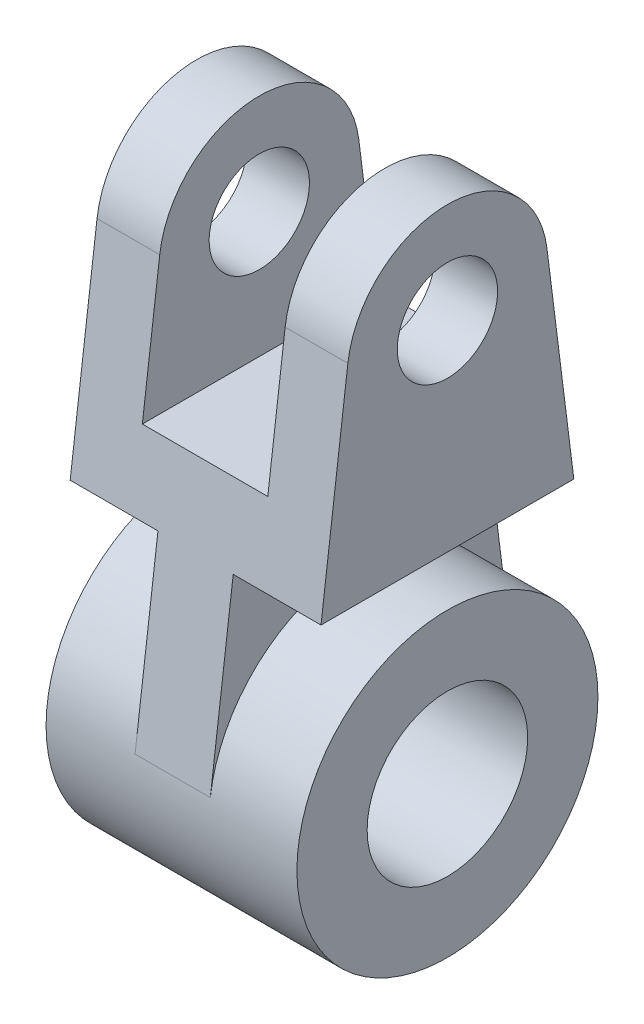
from build123d import *

# Parameters (mm, degrees)
SKETCH1_R               = 30
BOSS_EXTRUDE1_DEPTH     = 25
SKETCH2_R               = 16
CUT_EXTRUDE1_DEPTH      = 66.574385243
BOSS_EXTRUDE2_DEPTH     = 25
BOSS_EXTRUDE3_DEPTH     = 7.5
SKETCH4_R               = 10
CUT_EXTRUDE2_DEPTH      = 116.758369028
CUT_EXTRUDE3_DEPTH      = 108.354552768
CUT_EXTRUDE3_DEPTH_BACK = 108.354552768
SKETCH5_W               = 25
SKETCH5_H               = 45


with BuildPart() as part:
    # Sketch1 → Boss-Extrude1 (new, symmetric)
    with BuildSketch(Plane(origin=(0, 0, 0), x_dir=(0, 0, -1), z_dir=(1, 0, 0))):
        Circle(SKETCH1_R)
    extrude(amount=BOSS_EXTRUDE1_DEPTH, both=True)

    # Sketch2 → Cut-Extrude1 (cut, through all)
    with BuildSketch(Plane(origin=(25, 0, 0), x_dir=(0, 0, -1), z_dir=(1, 0, 0))):
        Circle(SKETCH2_R)
    extrude(amount=-CUT_EXTRUDE1_DEPTH, mode=Mode.SUBTRACT)



with BuildPart() as body_2:
    # Sketch3 → Boss-Extrude2 (new, symmetric)
    with BuildSketch(Plane(origin=(0, 0, 0), x_dir=(0, 0, -1), z_dir=(1, 0, 0))):
        with BuildLine():
            Line((-19.843134833, 82.5), (-25.197631534, 40))
            Line((-25.197631534, 40), (25.197631534, 40))
            Line((25.197631534, 40), (19.843134833, 82.5))
            ThreePointArc((19.843134833, 82.5), (0, 100), (-19.843134833, 82.5))
        make_face()
    extrude(amount=BOSS_EXTRUDE2_DEPTH, both=True)


with BuildPart() as part_1:
    add(part.part)

    add(body_2.part)  # Boss-Extrude3 merges body 2
    # Sketch3<3> → Boss-Extrude3 (add, symmetric)
    with BuildSketch(Plane(origin=(0, 0, 0), x_dir=(0, 0, -1), z_dir=(1, 0, 0))):
        with BuildLine():
            ThreePointArc((-29.764702249, 3.75), (0, 30), (29.764702249, 3.75))
            Line((29.764702249, 3.75), (25.197631534, 40))
            Line((25.197631534, 40), (-25.197631534, 40))
            Line((-25.197631534, 40), (-29.764702249, 3.75))
        make_face()
    extrude(amount=BOSS_EXTRUDE3_DEPTH, both=True)

    # Sketch4 → Cut-Extrude2 (cut, through all)
    with BuildSketch(Plane(origin=(25, 0, 0), x_dir=(0, 0, -1), z_dir=(1, 0, 0))):
        with Locations((0, 80)):
            Circle(SKETCH4_R)
    extrude(amount=-CUT_EXTRUDE2_DEPTH, mode=Mode.SUBTRACT)

    # Sketch5 → Cut-Extrude3 (cut, two sides: drawn at the far end of the back side and taken through both)
    with BuildSketch(Plane.XY.offset(-CUT_EXTRUDE3_DEPTH_BACK)):
        with Locations((0, 77.5)):
            Rectangle(SKETCH5_W, SKETCH5_H)
    extrude(amount=CUT_EXTRUDE3_DEPTH + CUT_EXTRUDE3_DEPTH_BACK, mode=Mode.SUBTRACT)


solid = part_1.part
